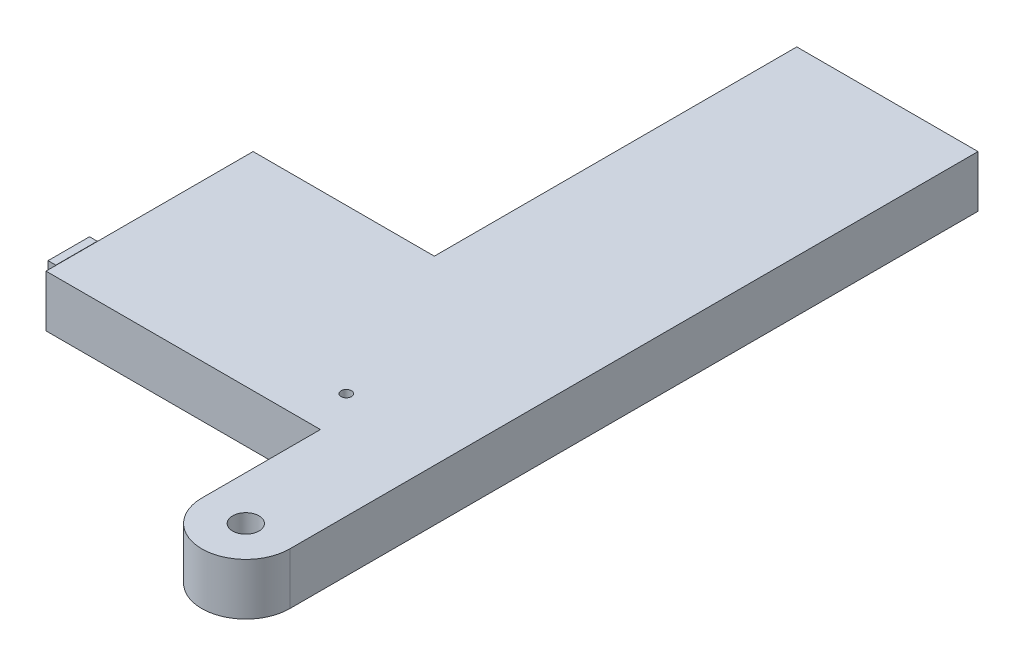
from build123d import *

# Parameters (mm, degrees)
CORNERBOSS_EXTRUDE1_DEPTH               = 20
SHELL1_T                                = -3
PADSKETCH1_R                            = 5
PADSKETCH1_R_2                          = 12
PADBOSS_EXTRUDE1_DEPTH                  = 10
STEPPERSHAFTCUT_SKETCH3_R               = 5.1
STEPPERSHAFTCUT_SKETCH3_R_2             = 2
STEPPERSHAFTCUT_EXTRUDE1_DEPTH          = 262.09193783
THREADEDNUTMOUNTHOLESSKETCH5_R          = 2
THREADEDNUTMOUNTHOLESCUT_EXTRUDE2_DEPTH = 10
TOPPEGHOLESKETCH4_W                     = 10
TOPPEGHOLESKETCH4_H                     = 14
TOPPEGHOLECUT_EXTRUDE2_DEPTH            = 3
BLPEGSKETCH5_W                          = 9.8
BLPEGSKETCH5_H                          = 13.9
BLPEGBOSS_EXTRUDE3_DEPTH                = 3.1
BLPEGCAPSKETCH6_W                       = 16
BLPEGCAPSKETCH6_H                       = 17
BLPEGCAPBOSS_EXTRUDE4_DEPTH             = 3
BEDCENTERPEGHOLECUTSKETCH1_W            = 10
BEDCENTERPEGHOLECUTSKETCH1_H            = 14
BEDCENTERPEGHOLECUT_EXTRUDE1_DEPTH      = 3


with BuildPart() as part:
    # CornerrSketch1 → CornerBoss-Extrude1 (new body)
    with BuildSketch(Plane(origin=(0, 0, 0), x_dir=(1, 0, 0), z_dir=(0, 1, 0))):
        with BuildLine():
            Line((0, 0), (0, 80))
            Line((0, 80), (70, 80))
            Line((70, 80), (70, 220))
            Line((70, 220), (140, 220))
            Line((140, 220), (140, -45.825))
            ThreePointArc((140, -45.825), (123, -62.825), (106, -45.825))
            Line((106, -45.825), (106, 0))
            Line((106, 0), (0, 0))
        make_face()
    extrude(amount=CORNERBOSS_EXTRUDE1_DEPTH)

    # Shell1
    shell1_openings = [part.faces().sort_by_distance(p)[0] for p in [
        (89.539211683, 0, -80.750143578),
    ]]
    offset(amount=SHELL1_T, openings=shell1_openings, kind=Kind.INTERSECTION)

    # PadSketch1 → PadBoss-Extrude1 (add)
    with BuildSketch(Plane.XZ.offset(-17)):
        with Locations(Location((99, -17, 0), (0, 0, 90))):
            Circle(PADSKETCH1_R)
        with Locations(Location((123, 45.825, 0), (0, 0, 90))):
            Circle(PADSKETCH1_R_2)
    extrude(amount=PADBOSS_EXTRUDE1_DEPTH)

    # StepperShaftCut-Sketch3 → StepperShaftCut-Extrude1 (cut, through all)
    with BuildSketch(Plane.XZ.offset(-7)):
        with Locations(Location((123, 45.825, 0), (0, 0, 270))):
            Circle(STEPPERSHAFTCUT_SKETCH3_R)
        with Locations(Location((99, -17, 0), (0, 0, 270))):
            Circle(STEPPERSHAFTCUT_SKETCH3_R_2)
    extrude(amount=-STEPPERSHAFTCUT_EXTRUDE1_DEPTH, mode=Mode.SUBTRACT)

    # ThreadedNutMountHolesSketch5 → ThreadedNutMountHolesCut-Extrude2 (cut)
    with BuildSketch(Plane.XZ.offset(-7)):
        with Locations(Location((123, 53.825, 0), (0, 0, 270))):
            Circle(THREADEDNUTMOUNTHOLESSKETCH5_R)
        with Locations(Location((131, 45.825, 0), (0, 0, 270))):
            Circle(THREADEDNUTMOUNTHOLESSKETCH5_R)
        with Locations(Location((115, 45.825, 0), (0, 0, 270))):
            Circle(THREADEDNUTMOUNTHOLESSKETCH5_R)
        with Locations(Location((123, 37.825, 0), (0, 0, 270))):
            Circle(THREADEDNUTMOUNTHOLESSKETCH5_R)
    extrude(amount=-THREADEDNUTMOUNTHOLESCUT_EXTRUDE2_DEPTH, mode=Mode.SUBTRACT)

    # TopPegHoleSketch4 → TopPegHoleCut-Extrude2 (cut)
    with BuildSketch(Plane(origin=(0, 0, -220), x_dir=(-1, 0, 0), z_dir=(0, 0, -1))):
        with Locations((-125, 7)):
            Rectangle(TOPPEGHOLESKETCH4_W, TOPPEGHOLESKETCH4_H)
    extrude(amount=-TOPPEGHOLECUT_EXTRUDE2_DEPTH, mode=Mode.SUBTRACT)

    # BLPegSketch5 → BLPegBoss-Extrude3 (add)
    with BuildSketch(Plane.ZY):
        with Locations((-15, 6.95)):
            Rectangle(BLPEGSKETCH5_W, BLPEGSKETCH5_H)
    extrude(amount=BLPEGBOSS_EXTRUDE3_DEPTH)

    # BLPegCapSketch6 → BLPegCapBoss-Extrude4 (add)
    with BuildSketch(Plane.ZY.offset(3.1)):
        with Locations((-14.9, 8.5)):
            Rectangle(BLPEGCAPSKETCH6_W, BLPEGCAPSKETCH6_H)
    extrude(amount=BLPEGCAPBOSS_EXTRUDE4_DEPTH)

    # BedCenterPegHoleCutSketch1 → BedCenterPegHoleCut-Extrude1 (cut)
    with BuildSketch(Plane.ZY.offset(-70)):
        with Locations((-185, 7)):
            Rectangle(BEDCENTERPEGHOLECUTSKETCH1_W, BEDCENTERPEGHOLECUTSKETCH1_H)
    extrude(amount=-BEDCENTERPEGHOLECUT_EXTRUDE1_DEPTH, mode=Mode.SUBTRACT)


solid = part.part
